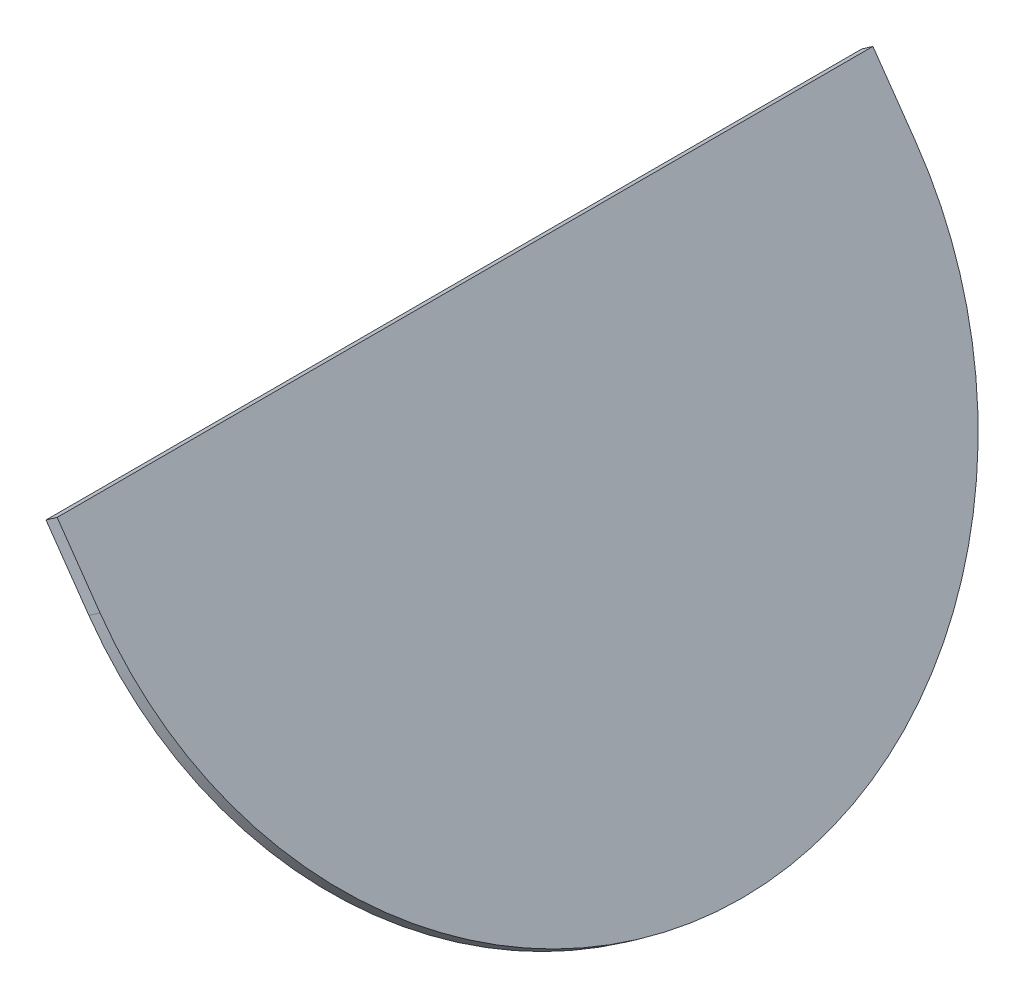
from build123d import *

# Parameters (mm, degrees)
BOSS_EXTRUDE1_DEPTH = 2


with BuildPart() as part:
    # Sketch2 → Boss-Extrude1 (new body)
    with BuildSketch(Plane(origin=(921.003735097, 644.893758034, 0), x_dir=(0, 0, -1), z_dir=(0.819152044288993, 0.5735764363510445, 0))):
        with BuildLine():
            Line((-1332.147446744, 341.176271901), (-1332.147446744, 330.176271901))
            ThreePointArc((-1332.147446744, 330.176271901), (-1272.147446744, 270.176271901), (-1212.147446744, 330.176271901))
            Line((-1212.147446744, 330.176271901), (-1212.147446744, 341.176271901))
            Line((-1212.147446744, 341.176271901), (-1332.147446744, 341.176271901))
        make_face()
    extrude(amount=-BOSS_EXTRUDE1_DEPTH)


solid = part.part
